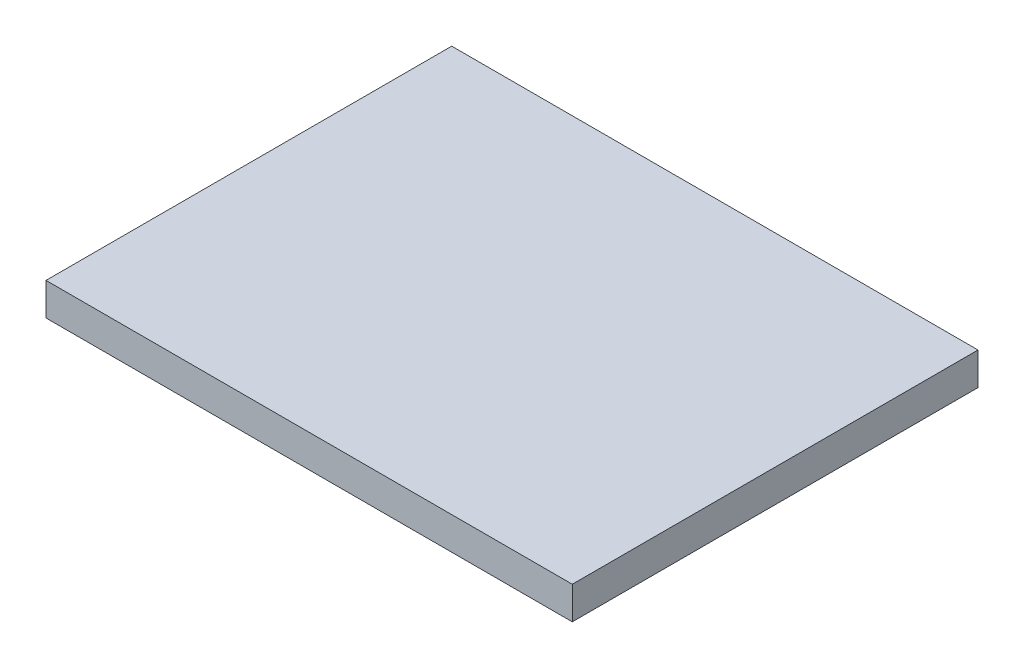
from build123d import *

# Parameters (mm, degrees)
SZKIC1_W                    = 323
SZKIC1_H                    = 249
DODANIE_WYCI_GNI_CIE1_DEPTH = 20


with BuildPart() as part:
    # Szkic1 → Dodanie-wyciągnięcie1 (new body)
    with BuildSketch(Plane(origin=(0, 0, 0), x_dir=(1, 0, 0), z_dir=(0, 1, 0))):
        Rectangle(SZKIC1_W, SZKIC1_H)
    extrude(amount=DODANIE_WYCI_GNI_CIE1_DEPTH)


solid = part.part
